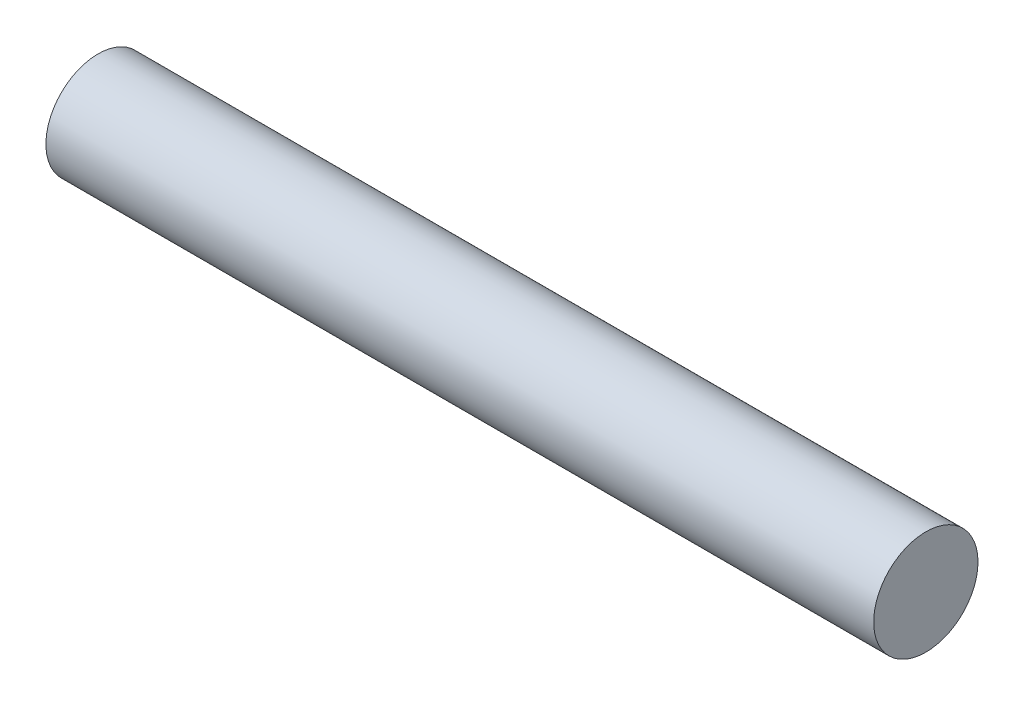
from build123d import *

# Parameters (mm, degrees)
SKETCH1_R           = 3
BOSS_EXTRUDE1_DEPTH = 47.6000064


with BuildPart() as part:
    # Sketch1 → Boss-Extrude1 (new body)
    with BuildSketch(Plane(origin=(0, 0, 0), x_dir=(0, 0, -1), z_dir=(1, 0, 0))):
        Circle(SKETCH1_R)
    extrude(amount=BOSS_EXTRUDE1_DEPTH)


solid = part.part
